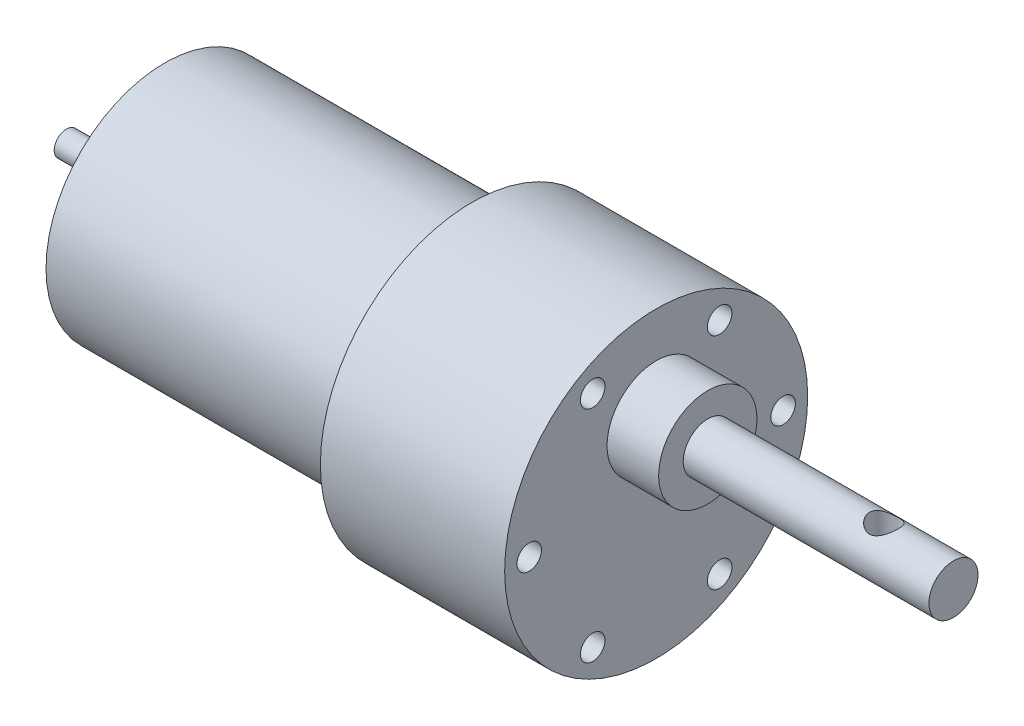
from build123d import *

# Parameters (mm, degrees)
SKETCH2_W          = 3
SKETCH2_H          = 3.5
SKETCH2_H_2        = 1.5
SKETCH2_W_2        = 9
SKETCH2_6_W        = 30
SKETCH2_6_H        = 3
SKETCH3_R          = 1.5
CUT_EXTRUDE1_DEPTH = 3.5
SKETCH4_R          = 1.75
CUT_EXTRUDE2_DEPTH = 104.464679964


with BuildPart() as part:
    # Sketch2 → Revolve2 (revolve)
    with BuildSketch(Plane.XY, mode=Mode.PRIVATE) as revolve2_sk:
        Polygon((0, 14.5), (37.5, 14.5), (37.5, 29), (0, 29), (0, 19.5), (0, 16), align=None)
        Polygon((37.5, 29), (37.5, 14.5), (60, 14.5), (60, 15.5), (60, 21.5), (60, 27.5), (60, 33), (37.5, 33), align=None)
        with Locations((-1.5, 17.75)):
            Rectangle(SKETCH2_W, SKETCH2_H)
        with Locations((-1.5, 15.25)):
            Rectangle(SKETCH2_W, SKETCH2_H_2)
        with Locations((-7.5, 15.25)):
            Rectangle(SKETCH2_W_2, SKETCH2_H_2)
    revolve(revolve2_sk.sketch.rotate(Axis((-31.266871865, 14.5, 0), (1, 0, 0)), 90), axis=Axis((-31.266871865, 14.5, 0), (1, 0, 0)))

    # Sketch2<6> → Revolve3 (revolve)
    with BuildSketch(Plane.XY, mode=Mode.PRIVATE) as revolve3_sk:
        Polygon((60, 27.5), (60, 21.5), (66.3, 21.5), (66.3, 24.5), (66.3, 27.5), align=None)
        with Locations((81.3, 23)):
            Rectangle(SKETCH2_6_W, SKETCH2_6_H)
    revolve(revolve3_sk.sketch.rotate(Axis((60, 21.5, 0), (1, 0, 0)), 90), axis=Axis((60, 21.5, 0), (1, 0, 0)))

    # Sketch3 → Cut-Extrude1 (cut)
    with BuildSketch(Plane(origin=(60, 0, 0), x_dir=(0, 0, -1), z_dir=(1, 0, 0))):
        with Locations((-15.5, 14.5)):
            Circle(SKETCH3_R)
        with Locations((-7.75, 27.923393759)):
            Circle(SKETCH3_R)
        with Locations((7.75, 27.923393759)):
            Circle(SKETCH3_R)
        with Locations((15.5, 14.5)):
            Circle(SKETCH3_R)
        with Locations((7.75, 1.076606241)):
            Circle(SKETCH3_R)
        with Locations((-7.75, 1.076606241)):
            Circle(SKETCH3_R)
    extrude(amount=-CUT_EXTRUDE1_DEPTH, mode=Mode.SUBTRACT)

    # Sketch4 → Cut-Extrude2 (cut, through all)
    with BuildSketch(Plane(origin=(0, 0, 0), x_dir=(1, 0, 0), z_dir=(0, 1, 0))):
        with Locations(Location((87.8, 0, 0), (0, 0, 90))):
            Circle(SKETCH4_R)
    extrude(amount=CUT_EXTRUDE2_DEPTH, mode=Mode.SUBTRACT)


solid = part.part
